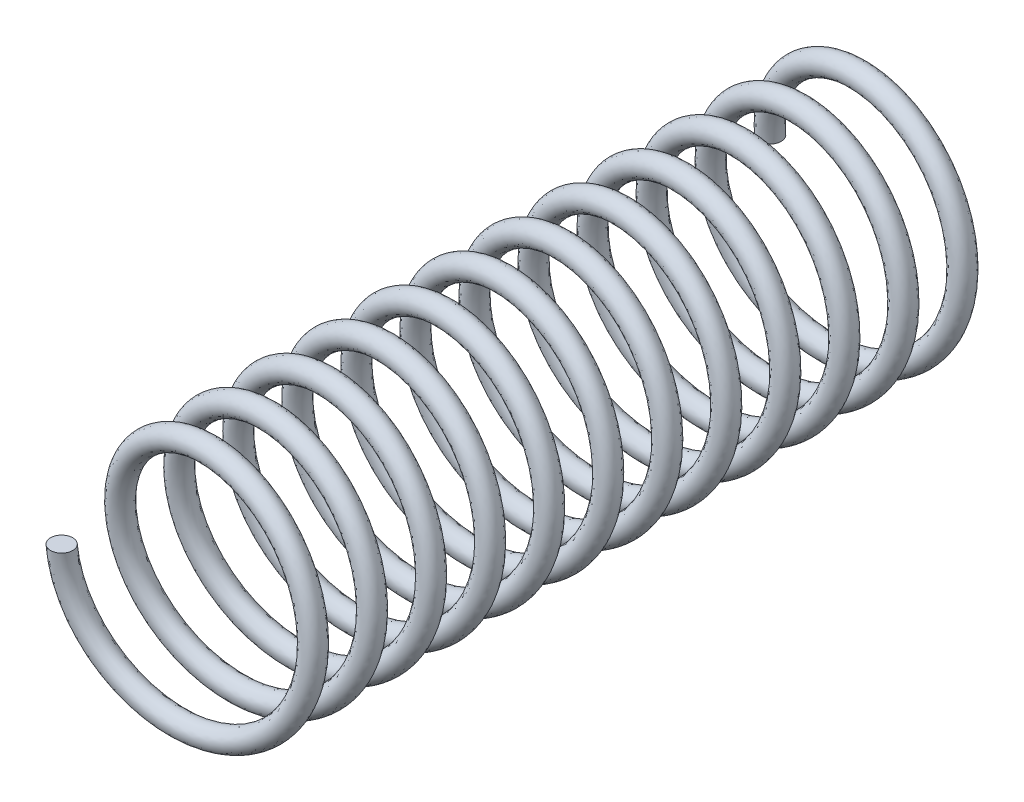
from build123d import *

# Parameters (mm, degrees)
SWEEP1_PITCH       = 4
SWEEP1_HEIGHT      = 48
SWEEP1_RADIUS      = 7.5
SWEEP1_START_ANGLE = -180
SKETCH2_R          = 0.75


with BuildPart() as part:
    # Sweep1: sweep along a helix
    with BuildLine() as sweep1_path:
        add(Helix(SWEEP1_PITCH, SWEEP1_HEIGHT, SWEEP1_RADIUS, center=(0, 0, 0), direction=(0, 0, 1), lefthand=True, mode=Mode.PRIVATE).rotate(Axis((0, 0, 0), (0, 0, 1)), SWEEP1_START_ANGLE))
    # Sketch2 → Sweep1 (sweep)
    with BuildSketch(Plane(origin=(0, 0, 0), x_dir=(1, 0, 0), z_dir=(0, 1, 0))):
        with Locations((-7.5, 0)):
            Circle(SKETCH2_R)
    sweep(path=sweep1_path.line, is_frenet=True)


solid = part.part
